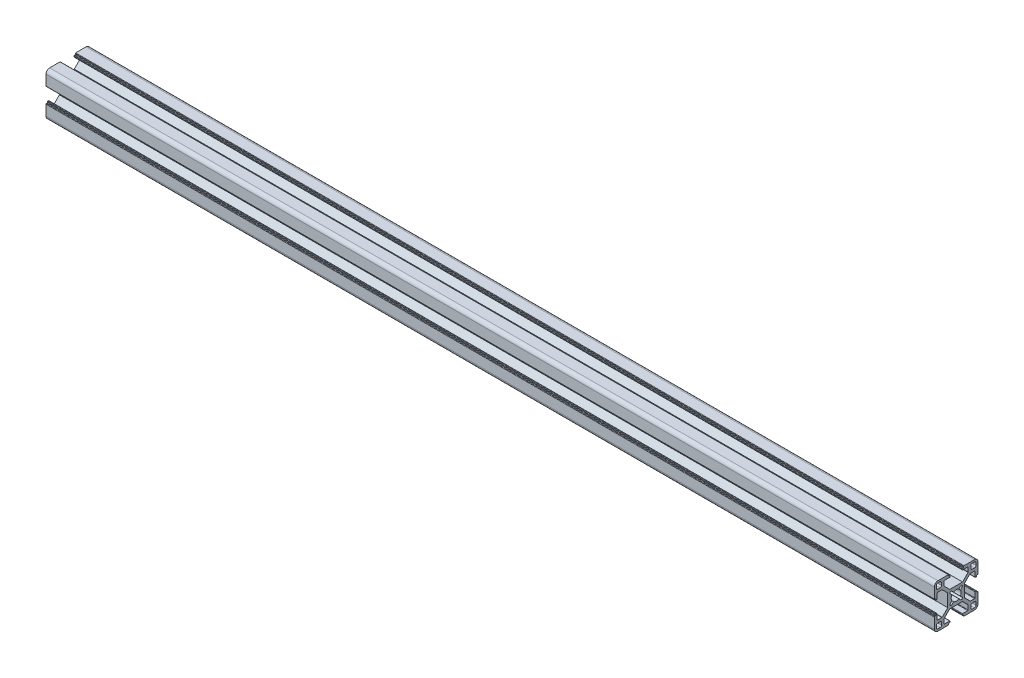
from build123d import *

# Parameters (mm, degrees)
SKETCH2_W                = 30
SKETCH2_H                = 30
BOSS_EXTRUDE1_DEPTH      = 610
SKETCH5_R                = 3.4
CUT_EXTRUDE2_DEPTH       = 611.368741008
CUT_EXTRUDE1_DEPTH       = 611.368741008
FILLET1_R                = 2.5
FILLET2_R                = 0.3
CIRPATTERN1_COUNT        = 4
FILLET1_OF_CIRPATTERN1_R = 2.5
FILLET2_OF_CIRPATTERN1_R = 0.3


with BuildPart() as part:
    # Sketch2 → Boss-Extrude1 (new body)
    with BuildSketch(Plane(origin=(0, 0, 0), x_dir=(0, 0, -1), z_dir=(1, 0, 0))):
        Rectangle(SKETCH2_W, SKETCH2_H)
    extrude(amount=BOSS_EXTRUDE1_DEPTH)

    # Sketch5 → Cut-Extrude2 (cut, through all)
    with BuildSketch(Plane(origin=(610, 0, 0), x_dir=(0, 0, -1), z_dir=(1, 0, 0))):
        Circle(SKETCH5_R)
    extrude(amount=-CUT_EXTRUDE2_DEPTH, mode=Mode.SUBTRACT)

    # Sketch4 → Cut-Extrude1 (cut, through all)
    with BuildSketch(Plane(origin=(610, 0, 0), x_dir=(0, 0, -1), z_dir=(1, 0, 0))):
        with BuildLine():
            Line((-4.385786454, -5.8), (4.385786454, -5.8))
            Line((4.385786454, -5.8), (8.162132034, -9.57634558))
            ThreePointArc((8.162132034, -9.57634558), (8.22716386, -9.673672585), (8.25, -9.788477614))
            Line((8.25, -9.788477614), (8.25, -13))
            Line((8.25, -13), (4.1, -13))
            Line((4.1, -13), (4.1, -14))
            Line((4.1, -14), (5.1, -14))
            Line((5.1, -14), (5.1, -15))
            Line((5.1, -15), (-5.1, -15))
            Line((-5.1, -15), (-5.1, -14))
            Line((-5.1, -14), (-4.1, -14))
            Line((-4.1, -14), (-4.1, -13))
            Line((-4.1, -13), (-8.25, -13))
            Line((-8.25, -13), (-8.25, -9.788477614))
            ThreePointArc((-8.25, -9.788477614), (-8.22716386, -9.673672585), (-8.162132034, -9.57634558))
            Line((-8.162132034, -9.57634558), (-4.385786454, -5.8))
        make_face()
        with BuildLine():
            Line((11.05, -10.05), (12.65, -10.05))
            ThreePointArc((12.65, -10.05), (13.357106781, -10.342893219), (13.65, -11.05))
            Line((13.65, -11.05), (13.65, -12.65))
            ThreePointArc((13.65, -12.65), (13.357106781, -13.357106781), (12.65, -13.65))
            Line((12.65, -13.65), (11.05, -13.65))
            ThreePointArc((11.05, -13.65), (10.342893219, -13.357106781), (10.05, -12.65))
            Line((10.05, -12.65), (10.05, -11.05))
            ThreePointArc((10.05, -11.05), (10.342893219, -10.342893219), (11.05, -10.05))
        make_face()
        with BuildLine():
            Line((4.065863992, -3.00520382), (2.87527145, -1.814611278))
            ThreePointArc((2.87527145, -1.814611278), (2.404163056, -2.404163056), (1.814611278, -2.87527145))
            Line((1.814611278, -2.87527145), (3.00520382, -4.065863992))
            ThreePointArc((3.00520382, -4.065863992), (4.065863992, -4.065863992), (4.065863992, -3.00520382))
        make_face()
    cut_extrude1 = extrude(amount=-CUT_EXTRUDE1_DEPTH, mode=Mode.SUBTRACT)

    # Fillet1
    fillet1_edges = [part.edges().sort_by_distance(p)[0] for p in [
        (305, -15, -15),
    ]]
    fillet(fillet1_edges, radius=FILLET1_R)

    # Fillet2
    fillet2_edges = [part.edges().sort_by_distance(p)[0] for p in [
        (305, -14, -5.1),
        (305, -15, -5.1),
        (305, -14, -4.1),
        (305, -13, -4.1),
        (305, -13, -8.25),
        (305, -13, 8.25),
        (305, -13, 4.1),
        (305, -14, 4.1),
        (305, -14, 5.1),
        (305, -15, 5.1),
    ]]
    fillet(fillet2_edges, radius=FILLET2_R)

    # CirPattern1: Cut-Extrude1 ×4 about axis
    cirpattern1_axis = Axis((0, 0, 0), (1, 0, 0))
    for i in range(1, CIRPATTERN1_COUNT):
        add(cut_extrude1.rotate(cirpattern1_axis, i * 360 / CIRPATTERN1_COUNT), mode=Mode.SUBTRACT)

    # Fillet1 of CirPattern1
    fillet1_of_cirpattern1_edges = [part.edges().sort_by_distance(p)[0] for p in [
        (305, 15, -15),
        (305, 15, 15),
        (305, -15, 15),
    ]]
    fillet(fillet1_of_cirpattern1_edges, radius=FILLET1_OF_CIRPATTERN1_R)

    # Fillet2 of CirPattern1
    fillet2_of_cirpattern1_edges = [part.edges().sort_by_distance(p)[0] for p in [
        (305, 5.1, -14),
        (305, 5.1, -15),
        (305, 4.1, -14),
        (305, 4.1, -13),
        (305, 8.25, -13),
        (305, -8.25, -13),
        (305, -4.1, -13),
        (305, -4.1, -14),
        (305, -5.1, -14),
        (305, -5.1, -15),
        (305, 14, 5.1),
        (305, 15, 5.1),
        (305, 14, 4.1),
        (305, 13, 4.1),
        (305, 13, 8.25),
        (305, 13, -8.25),
        (305, 13, -4.1),
        (305, 14, -4.1),
        (305, 14, -5.1),
        (305, 15, -5.1),
        (305, -5.1, 14),
        (305, -5.1, 15),
        (305, -4.1, 14),
        (305, -4.1, 13),
        (305, -8.25, 13),
        (305, 8.25, 13),
        (305, 4.1, 13),
        (305, 4.1, 14),
        (305, 5.1, 14),
        (305, 5.1, 15),
    ]]
    fillet(fillet2_of_cirpattern1_edges, radius=FILLET2_OF_CIRPATTERN1_R)


solid = part.part
